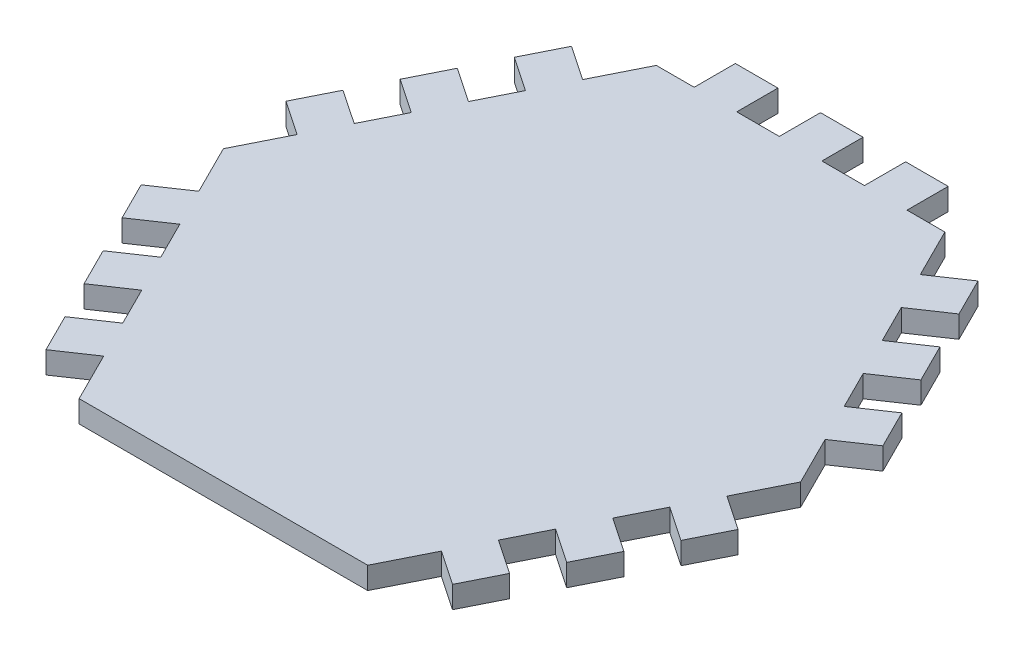
from build123d import *

# Parameters (mm, degrees)
BOSS_EXTRUDE1_DEPTH = 3.2


with BuildPart() as part:
    # Sketch1 → Boss-Extrude1 (new body)
    with BuildSketch(Plane(origin=(0, 0, 0), x_dir=(1, 0, 0), z_dir=(0, 1, 0))):
        Polygon((5.369694579, -35.29298371), (8.947903919, -28.137816492), (13.960969185, -31.527970224), (16.734685449, -25.98150779), (11.721620183, -22.591354059), (14.495336447, -17.044891626), (19.508401713, -20.435045357), (22.282117977, -14.888582924), (17.269052711, -11.498429192), (20.042768975, -5.951966759), (25.055834241, -9.34212049), (27.829550505, -3.795658057), (22.816485239, -0.405504326), (26.394694579, 6.749662892), (22.816485239, 13.90483011), (27.829550505, 17.294983841), (25.055834241, 22.841446275), (20.042768975, 19.451292543), (17.269052711, 24.997754977), (22.282117977, 28.387908708), (19.508401713, 33.934371141), (14.495336447, 30.54421741), (11.721620183, 36.090679843), (16.734685449, 39.480833575), (13.960969185, 45.027296008), (8.947903919, 41.637142277), (5.369694579, 48.792309495), (-0.14692929, 48.792309495), (-0.14692929, 54.792309495), (-6.348279742, 54.792309495), (-6.348279742, 48.792309495), (-12.549630195, 48.792309495), (-12.549630195, 54.792309495), (-18.750980648, 54.792309495), (-18.750980648, 48.792309495), (-24.9523311, 48.792309495), (-24.9523311, 54.792309495), (-31.153681553, 54.792309495), (-31.153681553, 48.792309495), (-36.670305421, 48.792309495), (-40.248514761, 41.637142277), (-45.261580028, 45.027296008), (-48.035296291, 39.480833575), (-43.022231025, 36.090679843), (-45.795947289, 30.54421741), (-50.809012555, 33.934371141), (-53.582728819, 28.387908708), (-48.569663553, 24.997754977), (-51.343379817, 19.451292543), (-56.356445083, 22.841446275), (-59.130161347, 17.294983841), (-54.117096081, 13.90483011), (-57.695305421, 6.749662892), (-54.117096081, -0.405504326), (-59.130161347, -3.795658057), (-56.356445083, -9.34212049), (-51.343379817, -5.951966759), (-48.569663553, -11.498429192), (-53.582728819, -14.888582924), (-50.809012555, -20.435045357), (-45.795947289, -17.044891626), (-43.022231025, -22.591354059), (-48.035296291, -25.98150779), (-45.261580028, -31.527970224), (-40.248514761, -28.137816492), (-36.670305421, -35.29298371), align=None)
    extrude(amount=BOSS_EXTRUDE1_DEPTH)


solid = part.part
